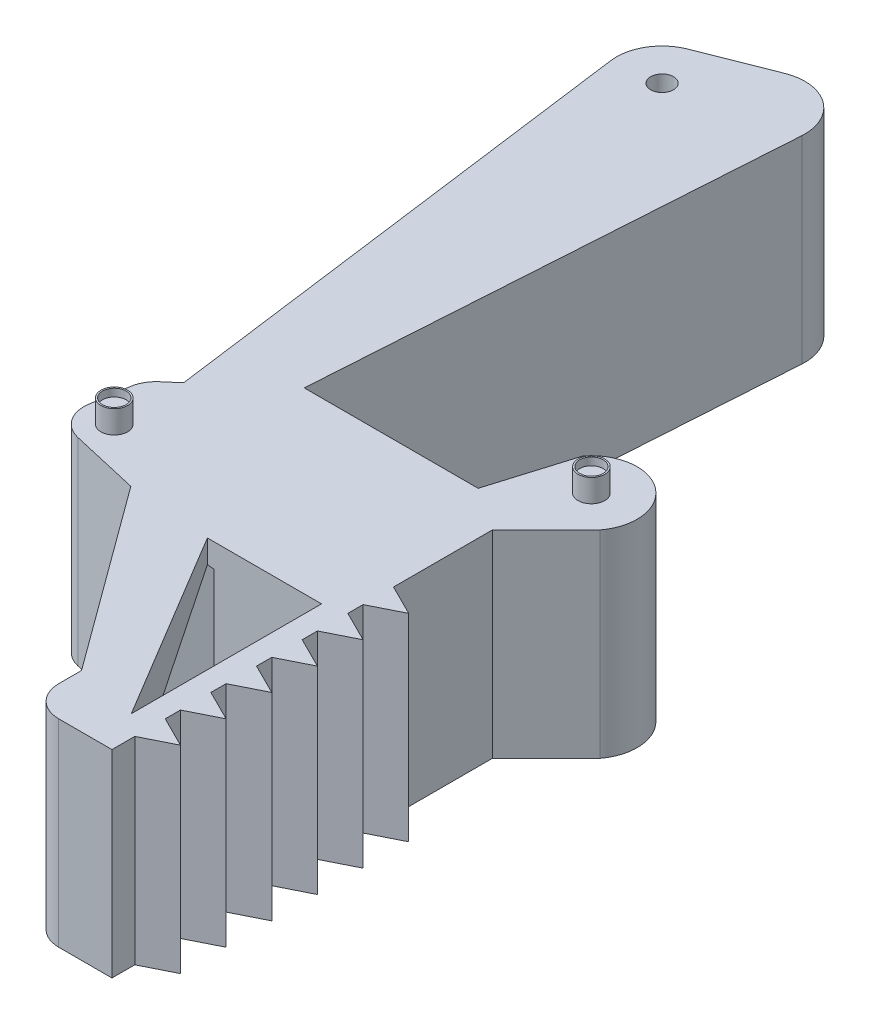
from build123d import *

# Parameters (mm, degrees)
BOSS_EXTRUDE1_DEPTH = 26
FILLET1_R           = 6
FILLET2_R           = 4
BOSS_EXTRUDE2_DEPTH = 26
LPATTERN1_COUNT     = 6
LPATTERN1_PITCH     = 6
CUT_EXTRUDE1_DEPTH  = 145.300050087
CUT_EXTRUDE2_DEPTH  = 9
SKETCH5_R           = 1.5
CUT_EXTRUDE3_DEPTH  = 145.300050087
SKETCH6_R           = 1.75
BOSS_EXTRUDE4_DEPTH = 3
SKETCH7_R           = 1.55
CUT_EXTRUDE4_DEPTH  = 1
SKETCH8_R           = 1.55
CUT_EXTRUDE9_DEPTH  = 1


with BuildPart() as part:
    # Sketch1 → Boss-Extrude1 (new body)
    with BuildSketch(Plane(origin=(0, 0, 0), x_dir=(1, 0, 0), z_dir=(0, 1, 0))):
        with BuildLine():
            Line((-50.731616693, -70.850705373), (-59.243664017, -78.187515911))
            Line((-59.243664017, -78.187515911), (-62.093532673, -80.643910429))
            Line((-62.093532673, -80.643910429), (-63.59680926, -90.530272728))
            Line((-63.59680926, -90.530272728), (-50.927362258, -93.443194403))
            Line((-50.927362258, -93.443194403), (-33.202701652, -117.647252046))
            Line((-33.202701652, -117.647252046), (-33.202701652, -124.647252046))
            Line((-33.202701652, -124.647252046), (-22.202701652, -124.647252046))
            Line((-22.202701652, -124.647252046), (-22.202701652, -74.647252046))
            Line((-22.202701652, -74.647252046), (-15.131633841, -67.576184234))
            ThreePointArc((-15.131633841, -67.576184234), (-16.26454773, -59.166873554), (-24.673858411, -60.299787444))
            Line((-24.673858411, -60.299787444), (-27.876609184, -70.850705373))
            Line((-27.876609184, -70.850705373), (-50.731616693, -70.850705373))
        make_face()
        Polygon((-50.731616693, -70.850705373), (-59.243664017, -78.187515911), (-68.459423033, -8.796812025), (-46.129709685, 0), align=None)
    extrude(amount=BOSS_EXTRUDE1_DEPTH)

    # Fillet1
    fillet1_edges = [part.edges().sort_by_distance(p)[0] for p in [
        (-68.459423033, 13, 8.796812025),
        (-46.129709685, 13, 0),
    ]]
    fillet(fillet1_edges, radius=FILLET1_R)

    # Fillet2
    fillet2_edges = [part.edges().sort_by_distance(p)[0] for p in [
        (-33.202701652, 13, 124.647252046),
        (-63.59680926, 13, 90.530272728),
        (-62.093532673, 13, 80.643910429),
    ]]
    fillet(fillet2_edges, radius=FILLET2_R)

    # Sketch2 → Boss-Extrude2 (add)
    with BuildSketch(Plane(origin=(0, 26, 0), x_dir=(1, 0, 0), z_dir=(0, 1, 0))):
        Polygon((-22.202701652, -119.647252046), (-22.202701652, -121.647252046), (-18.202701652, -119.647252046), align=None)
        Polygon((-22.202701652, -117.647252046), (-22.202701652, -119.647252046), (-18.202701652, -119.647252046), align=None)
    boss_extrude2 = extrude(amount=-BOSS_EXTRUDE2_DEPTH)

    # LPattern1: Boss-Extrude2 ×6
    with Locations(*[(0, 0, -i * LPATTERN1_PITCH) for i in range(1, LPATTERN1_COUNT)]):
        add(boss_extrude2)

    # Sketch3 → Cut-Extrude1 (cut, through all)
    with BuildSketch(Plane(origin=(0, 26, 0), x_dir=(1, 0, 0), z_dir=(0, 1, 0))):
        Polygon((-25.014177768, -119.292756392), (-25.014177768, -94.292756392), (-40.014177768, -94.292756392), align=None)
    extrude(amount=-CUT_EXTRUDE1_DEPTH, mode=Mode.SUBTRACT)

    # Sketch4 → Cut-Extrude2 (cut)
    with BuildSketch(Plane(origin=(-77.692274337, 0, 56.894146205), x_dir=(0.5908220201984185, 0, 0.8068019214458154), z_dir=(-0.8068019214458154, 0, 0.5908220201984185))):
        Polygon((52.301141737, 23), (52.301141737, 4.095051152), (70.301141737, 8.273318832), (70.301141737, 19.575190426), align=None)
    extrude(amount=-CUT_EXTRUDE2_DEPTH, mode=Mode.SUBTRACT)

    # Sketch5 → Cut-Extrude3 (cut, through all)
    with BuildSketch(Plane(origin=(0, 26, 0), x_dir=(1, 0, 0), z_dir=(0, 1, 0))):
        with Locations(Location((-61.893792149, -12.659081905, 0), (0, 0, 270))):
            Circle(SKETCH5_R)
    extrude(amount=-CUT_EXTRUDE3_DEPTH, mode=Mode.SUBTRACT)

    # Sketch6 → Boss-Extrude4 (add)
    with BuildSketch(Plane(origin=(0, 26, 0), x_dir=(1, 0, 0), z_dir=(0, 1, 0))):
        with Locations(Location((-59.084491881, -87.463369105, 0), (0, 0, 270))):
            Circle(SKETCH6_R)
        with Locations(Location((-19.902746126, -63.937985839, 0), (0, 0, 270))):
            Circle(SKETCH6_R)
    extrude(amount=BOSS_EXTRUDE4_DEPTH)

    # Sketch7 → Cut-Extrude4 (cut)
    with BuildSketch(Plane(origin=(0, 29, 0), x_dir=(1, 0, 0), z_dir=(0, 1, 0))):
        with Locations(Location((-59.084491881, -87.463369105, 0), (0, 0, 270))):
            Circle(SKETCH7_R)
    extrude(amount=-CUT_EXTRUDE4_DEPTH, mode=Mode.SUBTRACT)

    # Sketch8 → Cut-Extrude9 (cut)
    with BuildSketch(Plane(origin=(0, 29, 0), x_dir=(1, 0, 0), z_dir=(0, 1, 0))):
        with Locations(Location((-19.902746126, -63.937985839, 0), (0, 0, 270))):
            Circle(SKETCH8_R)
    extrude(amount=-CUT_EXTRUDE9_DEPTH, mode=Mode.SUBTRACT)


solid = part.part
